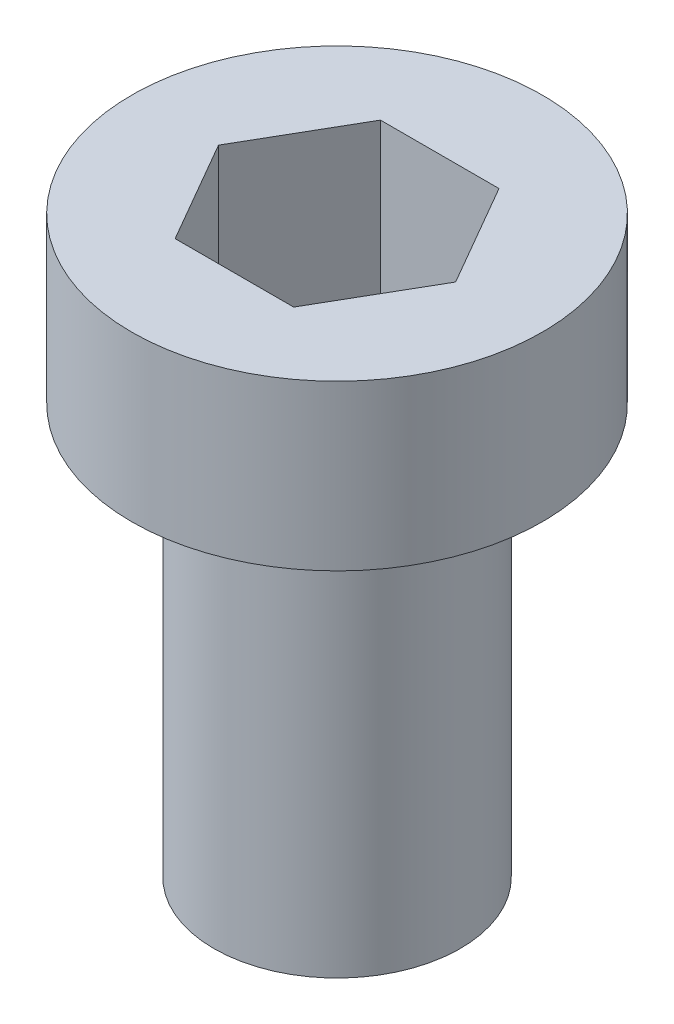
from build123d import *

# Parameters (mm, degrees)
SKETCH1_R      = 3
EXTRUDE1_DEPTH = 10
SKETCH2_R      = 5
EXTRUDE2_DEPTH = 4


with BuildPart() as part:
    # Sketch1 → Extrude1 (new body)
    with BuildSketch(Plane(origin=(0, 0, 0), x_dir=(1, 0, 0), z_dir=(0, 1, 0))):
        with Locations(Location((0, 0, 0), (0, 0, 270))):
            Circle(SKETCH1_R)
    extrude(amount=-EXTRUDE1_DEPTH)

    # Sketch2 → Extrude2 (add)
    with BuildSketch(Plane(origin=(0, 0, 0), x_dir=(1, 0, 0), z_dir=(0, 1, 0))):
        with Locations(Location((0, 0, 0), (0, 0, 270))):
            Circle(SKETCH2_R)
        Polygon((2.886751346, 0), (1.443375673, 2.5), (-1.443375673, 2.5), (-2.886751346, 0), (-1.443375673, -2.5), (1.443375673, -2.5), align=None, mode=Mode.SUBTRACT)
    extrude(amount=EXTRUDE2_DEPTH)


solid = part.part
